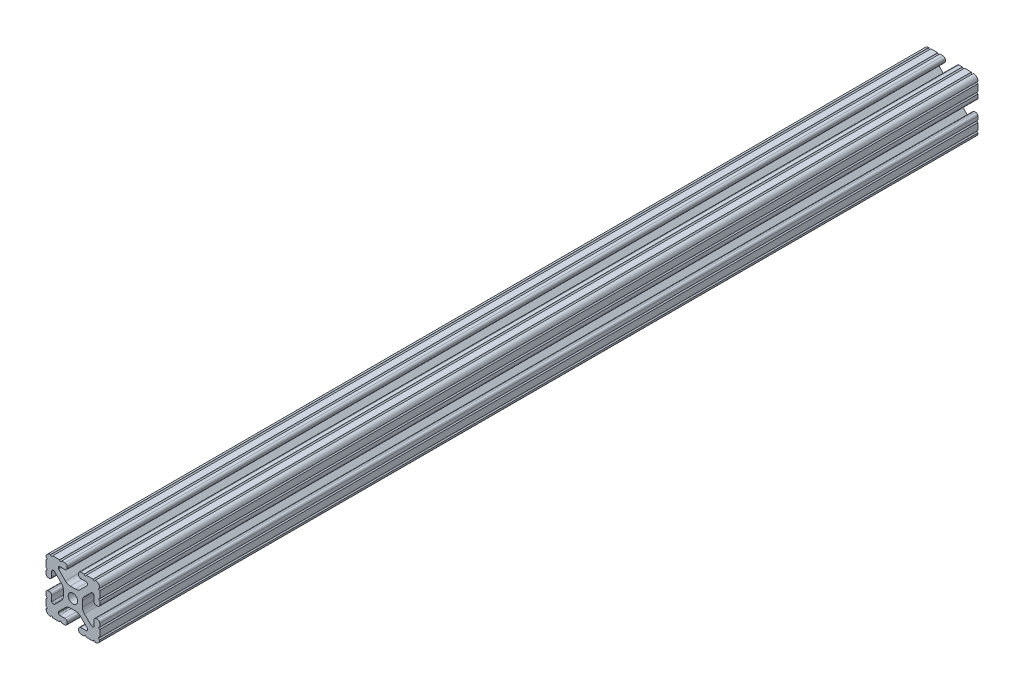
from build123d import *

# Parameters (mm, degrees)
SKETCH1_R                           = 3.3274
BOSS_EXTRUDE1_DEPTH                 = 622.3
SKETCH2_W                           = 3.175
SKETCH2_H                           = 25.788014764
F_38_0_25_DIAMETER_HOLE1_AT_2_COUNT = 2
F_38_0_25_DIAMETER_HOLE1_AT_2_PITCH = 254


with BuildPart() as part:
    # Sketch1 → Boss-Extrude1 (new body)
    with BuildSketch(Plane.XY):
        with BuildLine():
            Line((-14.097, 10.287), (-13.528918, 10.287))
            ThreePointArc((-13.528918, 10.287), (-13.188712428, 10.219328904), (-12.900300071, 10.026617928))
            Line((-12.900300071, 10.026617928), (-8.129198975, 5.255516832))
            ThreePointArc((-8.129198975, 5.255516832), (-7.09957176, 3.71457081), (-6.738014764, 1.896901043))
            Line((-6.738014764, 1.896901043), (-6.738014764, -1.896901043))
            ThreePointArc((-6.738014764, -1.896901043), (-7.09957176, -3.71457081), (-8.129198975, -5.255516832))
            Line((-8.129198975, -5.255516832), (-12.900300071, -10.026617928))
            ThreePointArc((-12.900300071, -10.026617928), (-13.188712428, -10.219328904), (-13.528918, -10.287))
            Line((-13.528918, -10.287), (-14.097, -10.287))
            ThreePointArc((-14.097, -10.287), (-14.725617928, -10.026617928), (-14.986, -9.398))
            Line((-14.986, -9.398), (-14.986, -5.6388))
            ThreePointArc((-14.986, -5.6388), (-15.447248241, -4.525248241), (-16.5608, -4.064))
            Line((-16.5608, -4.064), (-17.4752, -4.064))
            ThreePointArc((-17.4752, -4.064), (-18.588751759, -4.525248241), (-19.05, -5.6388))
            Line((-19.05, -5.6388), (-19.05, -7.9756))
            ThreePointArc((-19.05, -7.9756), (-18.288, -8.7376), (-19.05, -9.4996))
            Line((-19.05, -9.4996), (-19.05, -14.3256))
            ThreePointArc((-19.05, -14.3256), (-18.288, -15.0876), (-19.05, -15.8496))
            Line((-19.05, -15.8496), (-19.05, -15.875))
            ThreePointArc((-19.05, -15.875), (-18.12006403, -18.12006403), (-15.875, -19.05))
            Line((-15.875, -19.05), (-15.8496, -19.05))
            ThreePointArc((-15.8496, -19.05), (-15.0876, -18.288), (-14.3256, -19.05))
            Line((-14.3256, -19.05), (-9.4996, -19.05))
            ThreePointArc((-9.4996, -19.05), (-8.7376, -18.288), (-7.9756, -19.05))
            Line((-7.9756, -19.05), (-5.6388, -19.05))
            ThreePointArc((-5.6388, -19.05), (-4.525248241, -18.588751759), (-4.064, -17.4752))
            Line((-4.064, -17.4752), (-4.064, -16.5608))
            ThreePointArc((-4.064, -16.5608), (-4.525248241, -15.447248241), (-5.6388, -14.986))
            Line((-5.6388, -14.986), (-9.398, -14.986))
            ThreePointArc((-9.398, -14.986), (-10.026617928, -14.725617928), (-10.287, -14.097))
            Line((-10.287, -14.097), (-10.287, -13.528918))
            ThreePointArc((-10.287, -13.528918), (-10.219328904, -13.188712428), (-10.026617928, -12.900300071))
            Line((-10.026617928, -12.900300071), (-5.255516832, -8.129198975))
            ThreePointArc((-5.255516832, -8.129198975), (-3.71457081, -7.09957176), (-1.896901043, -6.738014764))
            Line((-1.896901043, -6.738014764), (1.896901043, -6.738014764))
            ThreePointArc((1.896901043, -6.738014764), (3.71457081, -7.09957176), (5.255516832, -8.129198975))
            Line((5.255516832, -8.129198975), (10.026617928, -12.900300071))
            ThreePointArc((10.026617928, -12.900300071), (10.219328904, -13.188712428), (10.287, -13.528918))
            Line((10.287, -13.528918), (10.287, -14.097))
            ThreePointArc((10.287, -14.097), (10.026617928, -14.725617928), (9.398, -14.986))
            Line((9.398, -14.986), (5.6388, -14.986))
            ThreePointArc((5.6388, -14.986), (4.525248241, -15.447248241), (4.064, -16.5608))
            Line((4.064, -16.5608), (4.064, -17.4752))
            ThreePointArc((4.064, -17.4752), (4.525248241, -18.588751759), (5.6388, -19.05))
            Line((5.6388, -19.05), (7.9756, -19.05))
            ThreePointArc((7.9756, -19.05), (8.7376, -18.288), (9.4996, -19.05))
            Line((9.4996, -19.05), (14.3256, -19.05))
            ThreePointArc((14.3256, -19.05), (15.0876, -18.288), (15.8496, -19.05))
            Line((15.8496, -19.05), (15.875, -19.05))
            ThreePointArc((15.875, -19.05), (18.12006403, -18.12006403), (19.05, -15.875))
            Line((19.05, -15.875), (19.05, -15.8496))
            ThreePointArc((19.05, -15.8496), (18.288, -15.0876), (19.05, -14.3256))
            Line((19.05, -14.3256), (19.05, -9.4996))
            ThreePointArc((19.05, -9.4996), (18.288, -8.7376), (19.05, -7.9756))
            Line((19.05, -7.9756), (19.05, -5.6388))
            ThreePointArc((19.05, -5.6388), (18.588751759, -4.525248241), (17.4752, -4.064))
            Line((17.4752, -4.064), (16.5608, -4.064))
            ThreePointArc((16.5608, -4.064), (15.447248241, -4.525248241), (14.986, -5.6388))
            Line((14.986, -5.6388), (14.986, -9.398))
            ThreePointArc((14.986, -9.398), (14.725617928, -10.026617928), (14.097, -10.287))
            Line((14.097, -10.287), (13.528918, -10.287))
            ThreePointArc((13.528918, -10.287), (13.188712428, -10.219328904), (12.900300071, -10.026617928))
            Line((12.900300071, -10.026617928), (8.129198975, -5.255516832))
            ThreePointArc((8.129198975, -5.255516832), (7.09957176, -3.71457081), (6.738014764, -1.896901043))
            Line((6.738014764, -1.896901043), (6.738014764, 1.896901043))
            ThreePointArc((6.738014764, 1.896901043), (7.09957176, 3.71457081), (8.129198975, 5.255516832))
            Line((8.129198975, 5.255516832), (12.900300071, 10.026617928))
            ThreePointArc((12.900300071, 10.026617928), (13.188712428, 10.219328904), (13.528918, 10.287))
            Line((13.528918, 10.287), (14.097, 10.287))
            ThreePointArc((14.097, 10.287), (14.725617928, 10.026617928), (14.986, 9.398))
            Line((14.986, 9.398), (14.986, 5.6388))
            ThreePointArc((14.986, 5.6388), (15.447248241, 4.525248241), (16.5608, 4.064))
            Line((16.5608, 4.064), (17.4752, 4.064))
            ThreePointArc((17.4752, 4.064), (18.588751759, 4.525248241), (19.05, 5.6388))
            Line((19.05, 5.6388), (19.05, 7.9756))
            ThreePointArc((19.05, 7.9756), (18.288, 8.7376), (19.05, 9.4996))
            Line((19.05, 9.4996), (19.05, 14.3256))
            ThreePointArc((19.05, 14.3256), (18.288, 15.0876), (19.05, 15.8496))
            Line((19.05, 15.8496), (19.05, 15.875))
            ThreePointArc((19.05, 15.875), (18.12006403, 18.12006403), (15.875, 19.05))
            Line((15.875, 19.05), (15.8496, 19.05))
            ThreePointArc((15.8496, 19.05), (15.0876, 18.288), (14.3256, 19.05))
            Line((14.3256, 19.05), (9.4996, 19.05))
            ThreePointArc((9.4996, 19.05), (8.7376, 18.288), (7.9756, 19.05))
            Line((7.9756, 19.05), (5.6388, 19.05))
            ThreePointArc((5.6388, 19.05), (4.525248241, 18.588751759), (4.064, 17.4752))
            Line((4.064, 17.4752), (4.064, 16.5608))
            ThreePointArc((4.064, 16.5608), (4.525248241, 15.447248241), (5.6388, 14.986))
            Line((5.6388, 14.986), (9.398, 14.986))
            ThreePointArc((9.398, 14.986), (10.026617928, 14.725617928), (10.287, 14.097))
            Line((10.287, 14.097), (10.287, 13.528918))
            ThreePointArc((10.287, 13.528918), (10.219328904, 13.188712428), (10.026617928, 12.900300071))
            Line((10.026617928, 12.900300071), (5.255516832, 8.129198975))
            ThreePointArc((5.255516832, 8.129198975), (3.71457081, 7.09957176), (1.896901043, 6.738014764))
            Line((1.896901043, 6.738014764), (-1.896901043, 6.738014764))
            ThreePointArc((-1.896901043, 6.738014764), (-3.71457081, 7.09957176), (-5.255516832, 8.129198975))
            Line((-5.255516832, 8.129198975), (-10.026617928, 12.900300071))
            ThreePointArc((-10.026617928, 12.900300071), (-10.219328904, 13.188712428), (-10.287, 13.528918))
            Line((-10.287, 13.528918), (-10.287, 14.097))
            ThreePointArc((-10.287, 14.097), (-10.026617928, 14.725617928), (-9.398, 14.986))
            Line((-9.398, 14.986), (-5.6388, 14.986))
            ThreePointArc((-5.6388, 14.986), (-4.525248241, 15.447248241), (-4.064, 16.5608))
            Line((-4.064, 16.5608), (-4.064, 17.4752))
            ThreePointArc((-4.064, 17.4752), (-4.525248241, 18.588751759), (-5.6388, 19.05))
            Line((-5.6388, 19.05), (-7.9756, 19.05))
            ThreePointArc((-7.9756, 19.05), (-8.7376, 18.288), (-9.4996, 19.05))
            Line((-9.4996, 19.05), (-14.3256, 19.05))
            ThreePointArc((-14.3256, 19.05), (-15.0876, 18.288), (-15.8496, 19.05))
            Line((-15.8496, 19.05), (-15.875, 19.05))
            ThreePointArc((-15.875, 19.05), (-18.12006403, 18.12006403), (-19.05, 15.875))
            Line((-19.05, 15.875), (-19.05, 15.8496))
            ThreePointArc((-19.05, 15.8496), (-18.288, 15.0876), (-19.05, 14.3256))
            Line((-19.05, 14.3256), (-19.05, 9.4996))
            ThreePointArc((-19.05, 9.4996), (-18.288, 8.7376), (-19.05, 7.9756))
            Line((-19.05, 7.9756), (-19.05, 5.6388))
            ThreePointArc((-19.05, 5.6388), (-18.588751759, 4.525248241), (-17.4752, 4.064))
            Line((-17.4752, 4.064), (-16.5608, 4.064))
            ThreePointArc((-16.5608, 4.064), (-15.447248241, 4.525248241), (-14.986, 5.6388))
            Line((-14.986, 5.6388), (-14.986, 9.398))
            ThreePointArc((-14.986, 9.398), (-14.725617928, 10.026617928), (-14.097, 10.287))
        make_face()
        Circle(SKETCH1_R, mode=Mode.SUBTRACT)
    extrude(amount=BOSS_EXTRUDE1_DEPTH)

    # Sketch2 → #38 (0.25) Diameter Hole1 (revolve, cut)
    with BuildSketch(Plane(origin=(0, 6.738014764, 438.15), x_dir=(0, 0, 1), z_dir=(1, 0, 0))):
        with Locations((1.5875, 12.894007382)):
            Rectangle(SKETCH2_W, SKETCH2_H)
    f_38_0_25_diameter_hole1 = revolve(axis=Axis((0, 13.088014764, 438.15), (0, -1, 0)), mode=Mode.SUBTRACT)

    # #38 (0.25) Diameter Hole1 at 2: #38 (0.25) Diameter Hole1 ×2
    with Locations(*[(0, 0, -i * F_38_0_25_DIAMETER_HOLE1_AT_2_PITCH) for i in range(1, F_38_0_25_DIAMETER_HOLE1_AT_2_COUNT)]):
        add(f_38_0_25_diameter_hole1, mode=Mode.SUBTRACT)


solid = part.part
